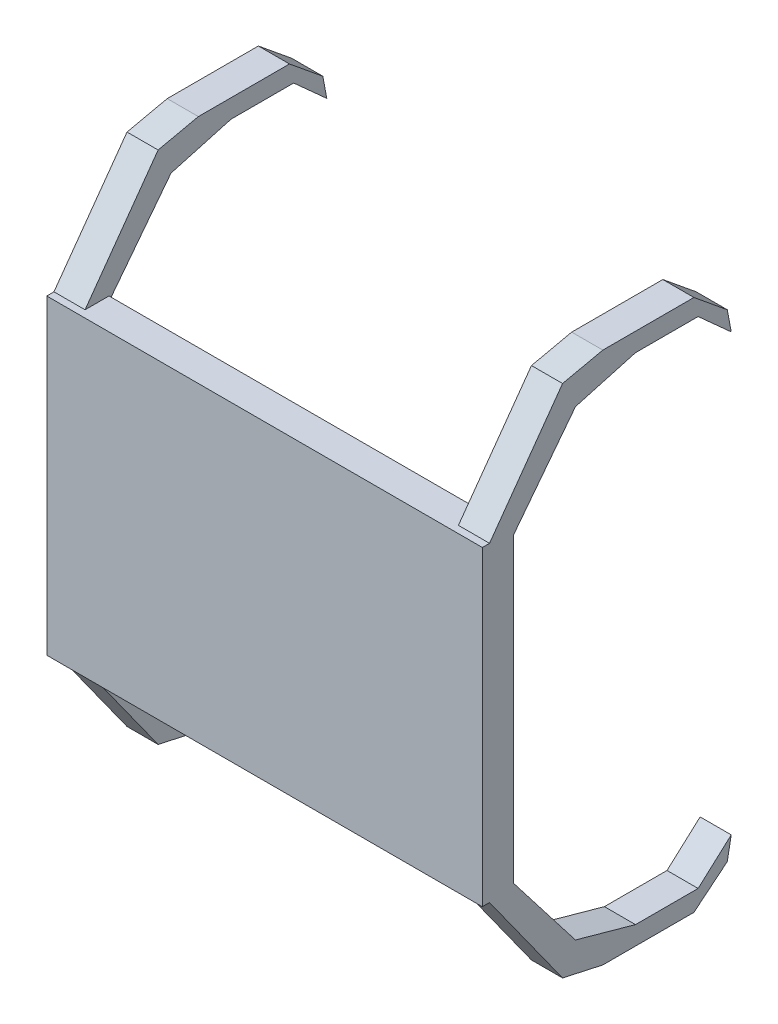
from build123d import *

# Parameters (mm, degrees)
SKETCH1_W            = 70
SKETCH1_H            = 50
BOSS_EXTRUDE1_DEPTH  = 5
BOSS_EXTRUDE2_DEPTH  = 5
MIRROR2_COPY_1_DEPTH = 5


with BuildPart() as part:
    # Sketch1 → Boss-Extrude1 (new body)
    with BuildSketch(Plane.XY):
        Rectangle(SKETCH1_W, SKETCH1_H)
    extrude(amount=BOSS_EXTRUDE1_DEPTH)

    # Sketch2 → Boss-Extrude2 (add)
    with BuildSketch(Plane.ZY.offset(35)):
        Polygon((3.843440475, -25), (-7.895535709, -41.369324188), (-14.361094855, -42.788640383), (-29.004505052, -42.788640383), (-34.365162286, -38.4026481), (-35, -35), (-29.677149334, -39.79641498), (-19.61481892, -39.79641498), (-9.962095697, -37.111555615), (0, -24.21921522), align=None)
    boss_extrude2 = extrude(amount=-BOSS_EXTRUDE2_DEPTH)

    # Mirror1: Boss-Extrude2 across plane
    add(boss_extrude2.mirror(Plane.ZX))

    # Mirror2: Boss-Extrude2 across plane
    add(boss_extrude2.mirror(Plane(origin=(0, 0, 0), x_dir=(0, 0, 1), z_dir=(1, 0, 0))))

    # Mirror2 copy 1 sketch → Mirror2 copy 1 (add)
    with BuildSketch(Plane(origin=(35, 0, 0), x_dir=(0, 0, 1), z_dir=(1, 0, 0))):
        Polygon((3.843440475, -25), (-7.895535709, -41.369324188), (-14.361094855, -42.788640383), (-29.004505052, -42.788640383), (-34.365162286, -38.4026481), (-35, -35), (-29.677149334, -39.79641498), (-19.61481892, -39.79641498), (-9.962095697, -37.111555615), (0, -24.21921522), align=None)
    extrude(amount=-MIRROR2_COPY_1_DEPTH)


solid = part.part
